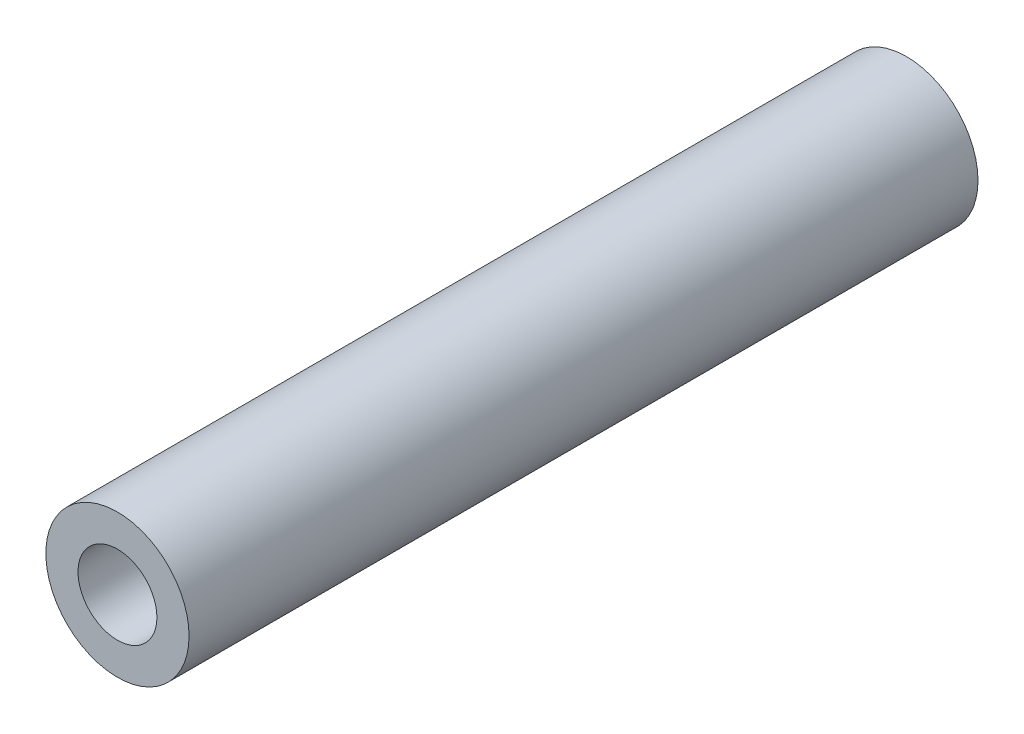
from build123d import *

# Parameters (mm, degrees)
SKETCH1_R           = 4.6101
SKETCH1_R_2         = 2.54
BOSS_EXTRUDE1_DEPTH = 50.8


with BuildPart() as part:
    # Sketch1 → Boss-Extrude1 (new body)
    with BuildSketch(Plane(origin=(0, 0, 0), x_dir=(0, 1, 0), z_dir=(0, 0, 1))):
        with Locations(Location((0, 0, 0), (0, 0, 270))):
            Circle(SKETCH1_R)
        with Locations(Location((0, 0, 0), (0, 0, 270))):
            Circle(SKETCH1_R_2, mode=Mode.SUBTRACT)
    extrude(amount=BOSS_EXTRUDE1_DEPTH)


solid = part.part
